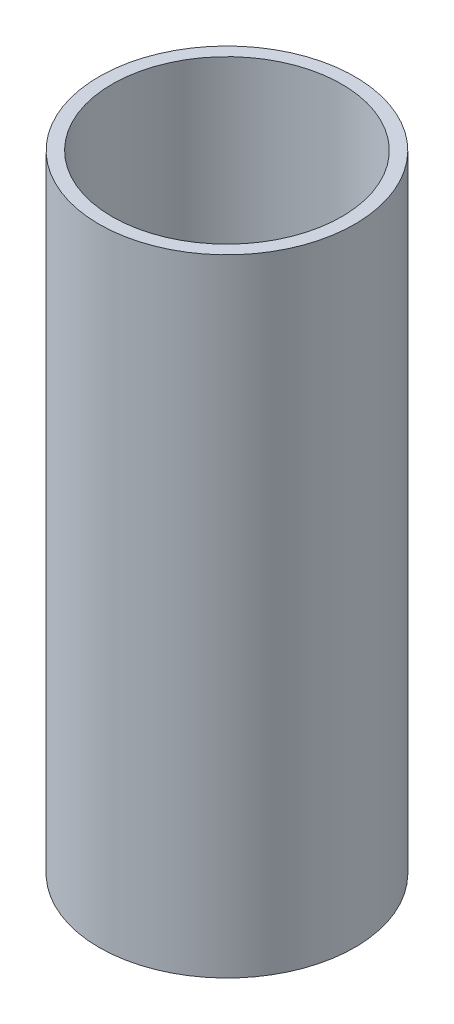
from build123d import *

# Parameters (mm, degrees)
SKETCH1_R           = 4.9
SKETCH1_R_2         = 4.4
BOSS_EXTRUDE1_DEPTH = 12


with BuildPart() as part:
    # Sketch1 → Boss-Extrude1 (new, symmetric)
    with BuildSketch(Plane(origin=(0, 0, 0), x_dir=(1, 0, 0), z_dir=(0, 1, 0))):
        with Locations(Location((0, 0, 0), (0, 0, 270))):
            Circle(SKETCH1_R)
        with Locations(Location((0, 0, 0), (0, 0, 270))):
            Circle(SKETCH1_R_2, mode=Mode.SUBTRACT)
    extrude(amount=BOSS_EXTRUDE1_DEPTH, both=True)


solid = part.part
